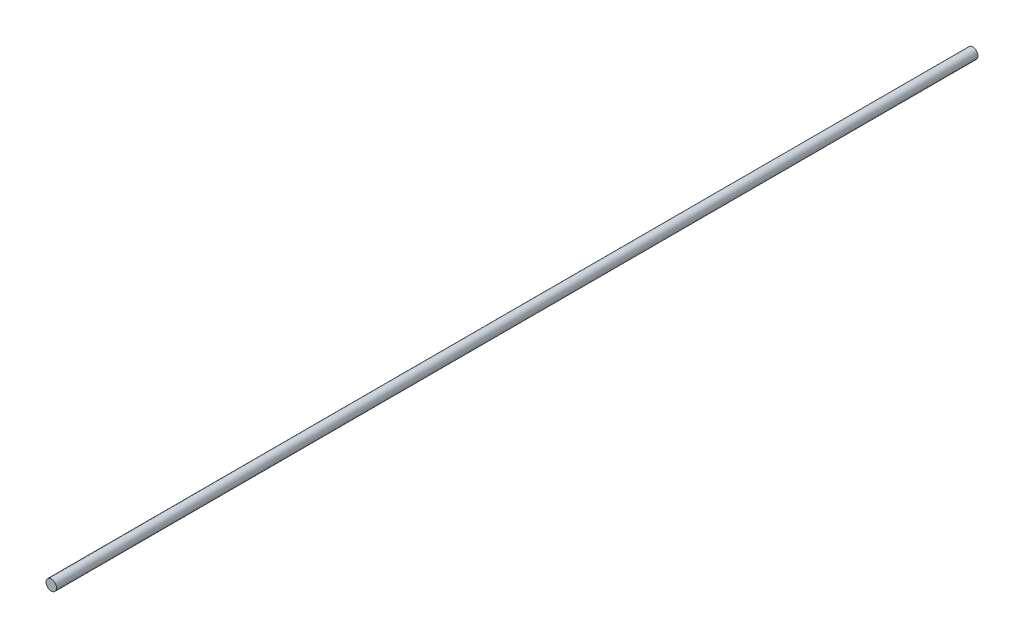
from build123d import *

# Parameters (mm, degrees)
SKETCH1_R           = 2.5
BOSS_EXTRUDE1_DEPTH = 220


with BuildPart() as part:
    # Sketch1 → Boss-Extrude1 (new, symmetric)
    with BuildSketch(Plane.XY):
        Circle(SKETCH1_R)
    extrude(amount=BOSS_EXTRUDE1_DEPTH, both=True)


solid = part.part
